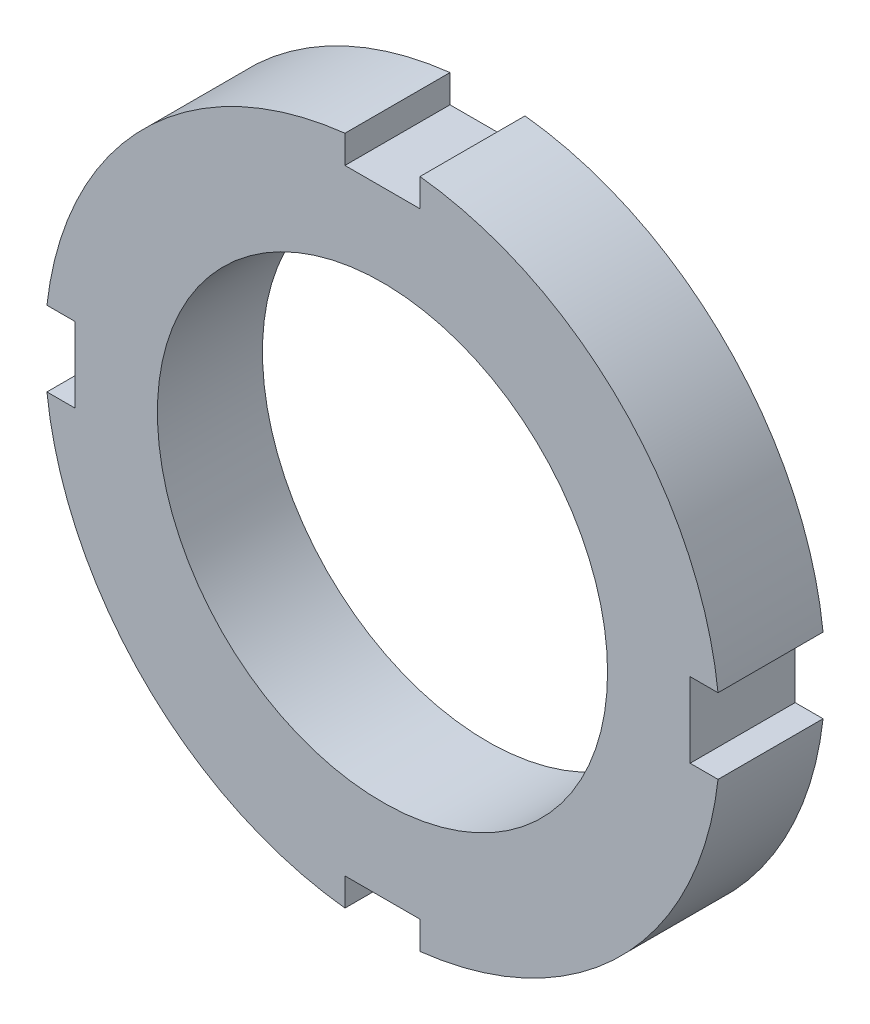
from build123d import *

# Parameters (mm, degrees)
SKETCH1_W            = 7.5
SKETCH1_H            = 7
SKETCH2_W            = 3
SKETCH2_H            = 5
SKETCH2_W_2          = 5
SKETCH2_H_2          = 3
CUT_4XSLOT_5X2_DEPTH = 150


with BuildPart() as part:
    # Sketch1 → REV_KM6_M30x1.5_45x7 (revolve)
    with BuildSketch(Plane(origin=(0, 0, 0), x_dir=(1, 0, 0), z_dir=(0, 1, 0))):
        with Locations((18.75, 92.5)):
            Rectangle(SKETCH1_W, SKETCH1_H)
    revolve(axis=Axis((0, 0, 150), (0, 0, -1)))

    # Sketch2 → CUT_4xSlot_5x2 (cut, symmetric)
    with BuildSketch(Plane.XY):
        with Locations((22, 0)):
            Rectangle(SKETCH2_W, SKETCH2_H)
        with Locations((-22, 0)):
            Rectangle(SKETCH2_W, SKETCH2_H)
        with Locations((0, 22)):
            Rectangle(SKETCH2_W_2, SKETCH2_H_2)
        with Locations((0, -22)):
            Rectangle(SKETCH2_W_2, SKETCH2_H_2)
    extrude(amount=CUT_4XSLOT_5X2_DEPTH, both=True, mode=Mode.SUBTRACT)


solid = part.part
